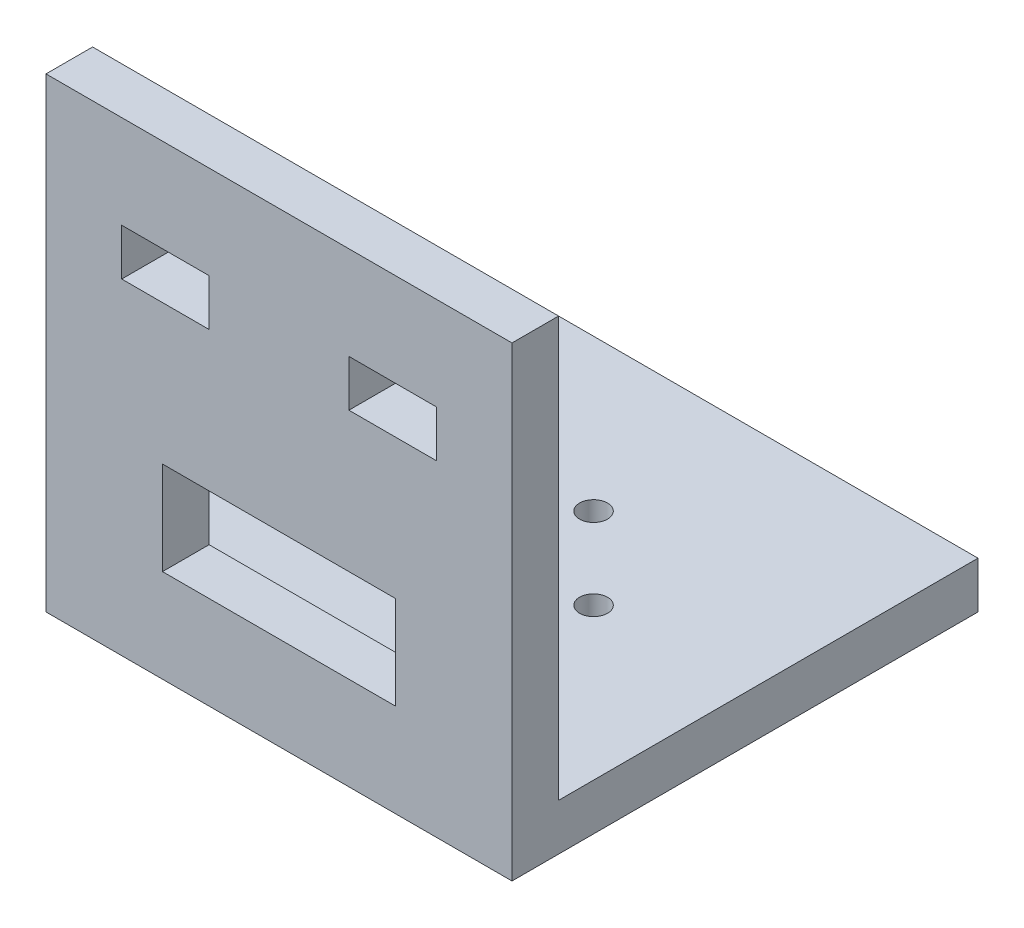
from build123d import *

# Parameters (mm, degrees)
SKETCH1_W           = 40
SKETCH1_H           = 40
SKETCH1_R           = 2
SKETCH1_R_2         = 1.2
BOSS_EXTRUDE1_DEPTH = 4
SKETCH2_W           = 40
SKETCH2_H           = 40
BOSS_EXTRUDE2_DEPTH = 4
SKETCH3_W           = 7.5
SKETCH3_H           = 4
SKETCH3_W_2         = 20
SKETCH3_H_2         = 8
CUT_EXTRUDE1_DEPTH  = 4


with BuildPart() as part:
    # Sketch1 → Boss-Extrude1 (new body)
    with BuildSketch(Plane(origin=(0, 0, 0), x_dir=(1, 0, 0), z_dir=(0, 1, 0))):
        Rectangle(SKETCH1_W, SKETCH1_H)
        with Locations(Location((0, 0, 0), (0, 0, 270))):
            Circle(SKETCH1_R, mode=Mode.SUBTRACT)
        with Locations(Location((7, 0, 0), (0, 0, 270))):
            Circle(SKETCH1_R_2, mode=Mode.SUBTRACT)
        with Locations(Location((0, -7, 0), (0, 0, 270))):
            Circle(SKETCH1_R_2, mode=Mode.SUBTRACT)
        with Locations(Location((-7, 0, 0), (0, 0, 270))):
            Circle(SKETCH1_R_2, mode=Mode.SUBTRACT)
        with Locations(Location((0, 7, 0), (0, 0, 270))):
            Circle(SKETCH1_R_2, mode=Mode.SUBTRACT)
    extrude(amount=BOSS_EXTRUDE1_DEPTH)

    # Sketch2 → Boss-Extrude2 (add)
    with BuildSketch(Plane.XY.offset(20)):
        with Locations((0, 20)):
            Rectangle(SKETCH2_W, SKETCH2_H)
    extrude(amount=-BOSS_EXTRUDE2_DEPTH)

    # Sketch3 → Cut-Extrude1 (cut)
    with BuildSketch(Plane.XY.offset(20)):
        with Locations((-9.75, 30)):
            Rectangle(SKETCH3_W, SKETCH3_H)
        with Locations((9.75, 30)):
            Rectangle(SKETCH3_W, SKETCH3_H)
        with Locations((0, 12)):
            Rectangle(SKETCH3_W_2, SKETCH3_H_2)
    extrude(amount=-CUT_EXTRUDE1_DEPTH, mode=Mode.SUBTRACT)


solid = part.part
